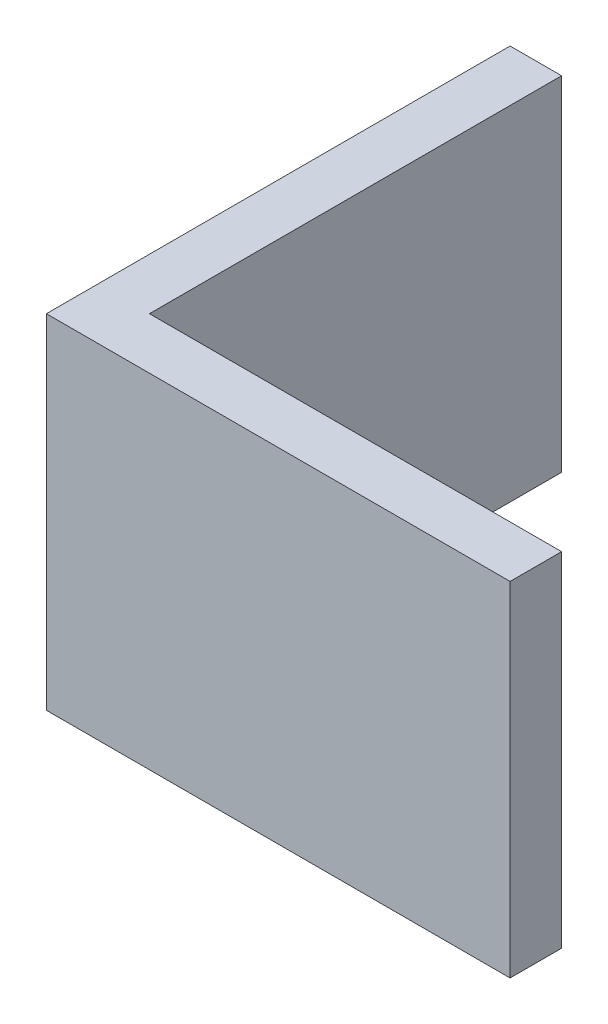
from build123d import *

# Parameters (mm, degrees)
BOSS_EXTRUDE1_DEPTH = 127


with BuildPart() as part:
    # Sketch1 → Boss-Extrude1 (new body)
    with BuildSketch(Plane(origin=(0, 0, 0), x_dir=(1, 0, 0), z_dir=(0, 1, 0))):
        Polygon((0, 0), (0, 171.45), (19.05, 171.45), (19.05, 19.05), (171.45, 19.05), (171.45, 0), align=None)
    extrude(amount=BOSS_EXTRUDE1_DEPTH)


solid = part.part
